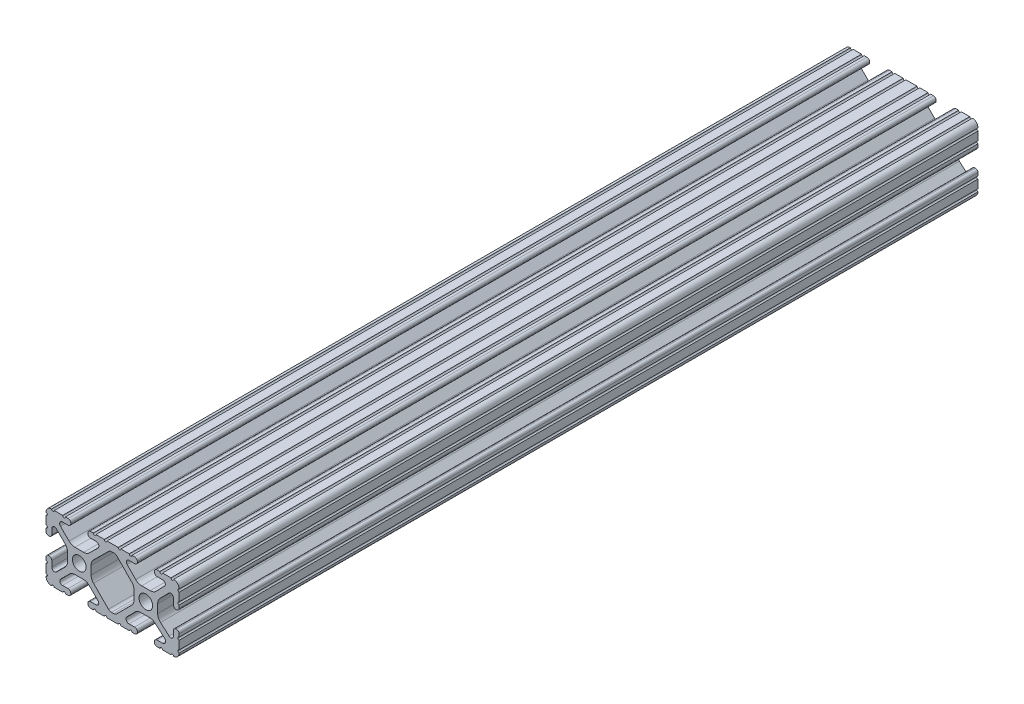
from build123d import *

# Parameters (mm, degrees)
SKETCH1_R           = 2.6035
BOSS_EXTRUDE1_DEPTH = 152.4


with BuildPart() as part:
    # Sketch1 → Boss-Extrude1 (new, symmetric)
    with BuildSketch(Plane.XY):
        with BuildLine():
            Line((18.01710265, 12.7), (16.98745015, 12.7))
            ThreePointArc((16.98745015, 12.7), (16.245730386, 12.392769614), (15.9385, 11.65104985))
            Line((15.9385, 11.65104985), (15.9385, 11.53922))
            ThreePointArc((15.9385, 11.53922), (16.245750844, 10.797450844), (16.98752, 10.4902))
            Line((16.98752, 10.4902), (19.116384363, 10.4902))
            ThreePointArc((19.116384363, 10.4902), (20.052502933, 9.869096983), (19.844087081, 8.765172272))
            Line((19.844087081, 8.765172272), (16.618993479, 5.455112286))
            ThreePointArc((16.618993479, 5.455112286), (15.578994274, 4.745442459), (14.344932584, 4.4958))
            Line((14.344932584, 4.4958), (11.083317835, 4.4958))
            ThreePointArc((11.083317835, 4.4958), (9.854330953, 4.743306833), (8.816955189, 5.447238587))
            Line((8.816955189, 5.447238587), (5.564154119, 8.762652677))
            ThreePointArc((5.564154119, 8.762652677), (5.352591412, 9.867473037), (6.289393385, 10.4902))
            Line((6.289393385, 10.4902), (8.41248, 10.4902))
            ThreePointArc((8.41248, 10.4902), (9.154249156, 10.797450844), (9.4615, 11.53922))
            Line((9.4615, 11.53922), (9.4615, 11.65104985))
            ThreePointArc((9.4615, 11.65104985), (9.154269614, 12.392769614), (8.41254985, 12.7))
            Line((8.41254985, 12.7), (7.38288465, 12.7))
            ThreePointArc((7.38288465, 12.7), (6.87488465, 12.192), (6.36688465, 12.7))
            Line((6.36688465, 12.7), (3.14958095, 12.7))
            ThreePointArc((3.14958095, 12.7), (2.64158095, 12.192), (2.13358095, 12.7))
            Line((2.13358095, 12.7), (-2.13358095, 12.7))
            ThreePointArc((-2.13358095, 12.7), (-2.64158095, 12.192), (-3.14958095, 12.7))
            Line((-3.14958095, 12.7), (-6.36689735, 12.7))
            ThreePointArc((-6.36689735, 12.7), (-6.87489735, 12.192), (-7.38289735, 12.7))
            Line((-7.38289735, 12.7), (-8.41254985, 12.7))
            ThreePointArc((-8.41254985, 12.7), (-9.154269614, 12.392769614), (-9.4615, 11.65104985))
            Line((-9.4615, 11.65104985), (-9.4615, 11.53922))
            ThreePointArc((-9.4615, 11.53922), (-9.154249156, 10.797450844), (-8.41248, 10.4902))
            Line((-8.41248, 10.4902), (-6.283641037, 10.4902))
            ThreePointArc((-6.283641037, 10.4902), (-5.297291557, 9.829633109), (-5.532576693, 8.666071843))
            Line((-5.532576693, 8.666071843), (-8.809985098, 5.416263103))
            ThreePointArc((-8.809985098, 5.416263103), (-9.836720513, 4.734920264), (-11.045536121, 4.4958))
            Line((-11.045536121, 4.4958), (-14.354463879, 4.4958))
            ThreePointArc((-14.354463879, 4.4958), (-15.563279487, 4.734920264), (-16.590014902, 5.416263103))
            Line((-16.590014902, 5.416263103), (-19.867423307, 8.666071843))
            ThreePointArc((-19.867423307, 8.666071843), (-20.102708443, 9.829633109), (-19.116358963, 10.4902))
            Line((-19.116358963, 10.4902), (-16.98752, 10.4902))
            ThreePointArc((-16.98752, 10.4902), (-16.245750844, 10.797450844), (-15.9385, 11.53922))
            Line((-15.9385, 11.53922), (-15.9385, 11.65104985))
            ThreePointArc((-15.9385, 11.65104985), (-16.245730386, 12.392769614), (-16.98745015, 12.7))
            Line((-16.98745015, 12.7), (-18.01711535, 12.7))
            ThreePointArc((-18.01711535, 12.7), (-18.52511535, 12.192), (-19.03311535, 12.7))
            Line((-19.03311535, 12.7), (-22.2504, 12.7))
            ThreePointArc((-22.2504, 12.7), (-22.758323491, 12.192000006), (-23.266399977, 12.699846982))
            ThreePointArc((-23.266399977, 12.699846982), (-24.782522516, 12.082522516), (-25.399846982, 10.566399977))
            ThreePointArc((-25.399846982, 10.566399977), (-24.892000006, 10.058323491), (-25.4, 9.5504))
            Line((-25.4, 9.5504), (-25.4, 6.3330836))
            ThreePointArc((-25.4, 6.3330836), (-24.892, 5.8250836), (-25.4, 5.3170836))
            Line((-25.4, 5.3170836), (-25.4, 4.237520184))
            ThreePointArc((-25.4, 4.237520184), (-25.107393763, 3.531106237), (-24.400979816, 3.2385))
            Line((-24.400979816, 3.2385), (-24.23922, 3.2385))
            ThreePointArc((-24.23922, 3.2385), (-23.497450844, 3.545750844), (-23.1902, 4.28752))
            Line((-23.1902, 4.28752), (-23.1902, 6.334741132))
            ThreePointArc((-23.1902, 6.334741132), (-22.556026952, 7.286023527), (-21.434002553, 7.066535717))
            Line((-21.434002553, 7.066535717), (-18.147950853, 3.808156468))
            ThreePointArc((-18.147950853, 3.808156468), (-17.452759693, 2.774838327), (-17.208501877, 1.553619571))
            Line((-17.208501877, 1.553619571), (-17.208501877, -1.695179196))
            ThreePointArc((-17.208501877, -1.695179196), (-17.450738657, -2.911536421), (-18.140486065, -3.942289578))
            Line((-18.140486065, -3.942289578), (-21.431579576, -7.227386226))
            ThreePointArc((-21.431579576, -7.227386226), (-22.55444896, -7.449940594), (-23.1902, -6.498002195))
            Line((-23.1902, -6.498002195), (-23.1902, -4.28752))
            ThreePointArc((-23.1902, -4.28752), (-23.497450844, -3.545750844), (-24.23922, -3.2385))
            Line((-24.23922, -3.2385), (-24.35098, -3.2385))
            ThreePointArc((-24.35098, -3.2385), (-25.092749156, -3.545750844), (-25.4, -4.28752))
            Line((-25.4, -4.28752), (-25.4, -5.3171344))
            ThreePointArc((-25.4, -5.3171344), (-24.892, -5.8251344), (-25.4, -6.3331344))
            Line((-25.4, -6.3331344), (-25.4, -9.5504))
            ThreePointArc((-25.4, -9.5504), (-24.892000006, -10.058323491), (-25.399846982, -10.566399977))
            ThreePointArc((-25.399846982, -10.566399977), (-24.782522516, -12.082522516), (-23.266399977, -12.699846982))
            ThreePointArc((-23.266399977, -12.699846982), (-22.758323491, -12.192000006), (-22.2504, -12.7))
            Line((-22.2504, -12.7), (-19.03308995, -12.7))
            ThreePointArc((-19.03308995, -12.7), (-18.52508995, -12.192), (-18.01708995, -12.7))
            Line((-18.01708995, -12.7), (-16.9874692, -12.7))
            ThreePointArc((-16.9874692, -12.7), (-16.245700044, -12.392749156), (-15.9384492, -11.65098))
            Line((-15.9384492, -11.65098), (-15.9384492, -11.53922))
            ThreePointArc((-15.9384492, -11.53922), (-16.245700044, -10.797450844), (-16.9874692, -10.4902))
            Line((-16.9874692, -10.4902), (-19.116358963, -10.4902))
            ThreePointArc((-19.116358963, -10.4902), (-20.055197748, -9.862578342), (-19.834124023, -8.755124678))
            Line((-19.834124023, -8.755124678), (-16.49660751, -5.423689618))
            ThreePointArc((-16.49660751, -5.423689618), (-15.467274017, -4.736928798), (-14.253591699, -4.4958))
            Line((-14.253591699, -4.4958), (-11.146408301, -4.4958))
            ThreePointArc((-11.146408301, -4.4958), (-9.932725983, -4.736928798), (-8.90339249, -5.423689618))
            Line((-8.90339249, -5.423689618), (-5.565875977, -8.755124678))
            ThreePointArc((-5.565875977, -8.755124678), (-5.344802252, -9.862578342), (-6.283641037, -10.4902))
            Line((-6.283641037, -10.4902), (-8.4125308, -10.4902))
            ThreePointArc((-8.4125308, -10.4902), (-9.154299956, -10.797450844), (-9.4615508, -11.53922))
            Line((-9.4615508, -11.53922), (-9.4615508, -11.65098))
            ThreePointArc((-9.4615508, -11.65098), (-9.154299956, -12.392749156), (-8.4125308, -12.7))
            Line((-8.4125308, -12.7), (-7.38287195, -12.7))
            ThreePointArc((-7.38287195, -12.7), (-6.87487195, -12.192), (-6.36687195, -12.7))
            Line((-6.36687195, -12.7), (-3.14960635, -12.7))
            ThreePointArc((-3.14960635, -12.7), (-2.64160635, -12.192), (-2.13360635, -12.7))
            Line((-2.13360635, -12.7), (2.13360635, -12.7))
            ThreePointArc((2.13360635, -12.7), (2.64159365, -12.1920127), (3.14958095, -12.7))
            Line((3.14958095, -12.7), (6.36691005, -12.7))
            ThreePointArc((6.36691005, -12.7), (6.87491005, -12.192), (7.38291005, -12.7))
            Line((7.38291005, -12.7), (8.4125308, -12.7))
            ThreePointArc((8.4125308, -12.7), (9.154299956, -12.392749156), (9.4615508, -11.65098))
            Line((9.4615508, -11.65098), (9.4615508, -11.53922))
            ThreePointArc((9.4615508, -11.53922), (9.154299956, -10.797450844), (8.4125308, -10.4902))
            Line((8.4125308, -10.4902), (6.289393385, -10.4902))
            ThreePointArc((6.289393385, -10.4902), (5.231590322, -9.783049717), (5.480677245, -8.535265862))
            Line((5.480677245, -8.535265862), (8.597933595, -5.423689618))
            ThreePointArc((8.597933595, -5.423689618), (9.627267088, -4.736928798), (10.840949406, -4.4958))
            Line((10.840949406, -4.4958), (14.102564155, -4.4958))
            ThreePointArc((14.102564155, -4.4958), (15.215927525, -4.697410182), (16.187895372, -5.276636531))
            Line((16.187895372, -5.276636531), (19.868247549, -8.482246082))
            ThreePointArc((19.868247549, -8.482246082), (20.188435806, -9.746879864), (19.116384363, -10.4902))
            Line((19.116384363, -10.4902), (16.9874692, -10.4902))
            ThreePointArc((16.9874692, -10.4902), (16.245700044, -10.797450844), (15.9384492, -11.53922))
            Line((15.9384492, -11.53922), (15.9384492, -11.65098))
            ThreePointArc((15.9384492, -11.65098), (16.245700044, -12.392749156), (16.9874692, -12.7))
            Line((16.9874692, -12.7), (18.01710265, -12.7))
            ThreePointArc((18.01710265, -12.7), (18.52510265, -12.192), (19.03310265, -12.7))
            Line((19.03310265, -12.7), (22.2504, -12.7))
            ThreePointArc((22.2504, -12.7), (22.758323491, -12.192000006), (23.266399977, -12.699846982))
            ThreePointArc((23.266399977, -12.699846982), (24.782522516, -12.082522516), (25.399846982, -10.566399977))
            ThreePointArc((25.399846982, -10.566399977), (24.892000006, -10.058323492), (25.4, -9.550400001))
            Line((25.4, -9.550400001), (25.4, -6.333083592))
            ThreePointArc((25.4, -6.333083592), (24.892000001, -5.825083593), (25.4, -5.317083593))
            Line((25.4, -5.317083593), (25.4, -4.237520184))
            ThreePointArc((25.4, -4.237520184), (25.107393763, -3.531106237), (24.400979816, -3.2385))
            Line((24.400979816, -3.2385), (24.189220184, -3.2385))
            ThreePointArc((24.189220184, -3.2385), (23.482806237, -3.531106237), (23.1902, -4.237520184))
            Line((23.1902, -4.237520184), (23.1902, -6.155876159))
            ThreePointArc((23.1902, -6.155876159), (22.62232736, -7.038258539), (21.583974541, -6.886926384))
            Line((21.583974541, -6.886926384), (18.29817066, -4.024970844))
            ThreePointArc((18.29817066, -4.024970844), (17.493730985, -2.946044689), (17.208501877, -1.630807374))
            Line((17.208501877, -1.630807374), (17.208501877, 1.630807374))
            ThreePointArc((17.208501877, 1.630807374), (17.442348332, 2.82673414), (18.109440981, 3.846495088))
            Line((18.109440981, 3.846495088), (21.526346532, 7.353420386))
            ThreePointArc((21.526346532, 7.353420386), (22.585896263, 7.574939077), (23.1902, 6.676867167))
            Line((23.1902, 6.676867167), (23.1902, 4.237520184))
            ThreePointArc((23.1902, 4.237520184), (23.482806237, 3.531106237), (24.189220184, 3.2385))
            Line((24.189220184, 3.2385), (24.400979816, 3.2385))
            ThreePointArc((24.400979816, 3.2385), (25.107393763, 3.531106237), (25.4, 4.237520184))
            Line((25.4, 4.237520184), (25.4, 5.3170836))
            ThreePointArc((25.4, 5.3170836), (24.891949193, 5.825134407), (25.4, 6.333185215))
            Line((25.4, 6.333185215), (25.4, 9.550400015))
            ThreePointArc((25.4, 9.550400015), (24.892000013, 10.058323498), (25.399846982, 10.566399977))
            ThreePointArc((25.399846982, 10.566399977), (24.782522516, 12.082522516), (23.266399977, 12.699846982))
            ThreePointArc((23.266399977, 12.699846982), (22.758323491, 12.192000006), (22.2504, 12.7))
            Line((22.2504, 12.7), (19.03310265, 12.7))
            ThreePointArc((19.03310265, 12.7), (18.52510265, 12.192), (18.01710265, 12.7))
        make_face()
        with Locations(Location((-12.7, 0, 0), (0, 0, 180))):
            Circle(SKETCH1_R, mode=Mode.SUBTRACT)
        with Locations(Location((12.7, 0, 0), (0, 0, 180))):
            Circle(SKETCH1_R, mode=Mode.SUBTRACT)
        with BuildLine():
            Line((-7.259513935, -3.869413038), (-1.545748891, -9.572766749))
            ThreePointArc((-1.545748891, -9.572766749), (-1.035199478, -9.913400116), (-0.433213048, -10.033))
            Line((-0.433213048, -10.033), (0.433213048, -10.033))
            ThreePointArc((0.433213048, -10.033), (1.035199478, -9.913400116), (1.545748891, -9.572766749))
            Line((1.545748891, -9.572766749), (7.259513935, -3.869413038))
            ThreePointArc((7.259513935, -3.869413038), (7.949261343, -2.838659881), (8.191498123, -1.622302656))
            Line((8.191498123, -1.622302656), (8.191498123, 1.622302656))
            ThreePointArc((8.191498123, 1.622302656), (7.955573352, 2.823327967), (7.282860769, 3.845864069))
            Line((7.282860769, 3.845864069), (1.675572808, 9.561086461))
            ThreePointArc((1.675572808, 9.561086461), (1.161034429, 9.910236611), (0.551456936, 10.033))
            Line((0.551456936, 10.033), (-0.395199982, 10.033))
            ThreePointArc((-0.395199982, 10.033), (-0.994772524, 9.914396349), (-1.50403329, 9.576450301))
            Line((-1.50403329, 9.576450301), (-7.252049147, 3.876839553))
            ThreePointArc((-7.252049147, 3.876839553), (-7.947240307, 2.843521412), (-8.191498123, 1.622302656))
            Line((-8.191498123, 1.622302656), (-8.191498123, -1.622302656))
            ThreePointArc((-8.191498123, -1.622302656), (-7.949261343, -2.838659881), (-7.259513935, -3.869413038))
        make_face(mode=Mode.SUBTRACT)
    extrude(amount=BOSS_EXTRUDE1_DEPTH, both=True)


solid = part.part
